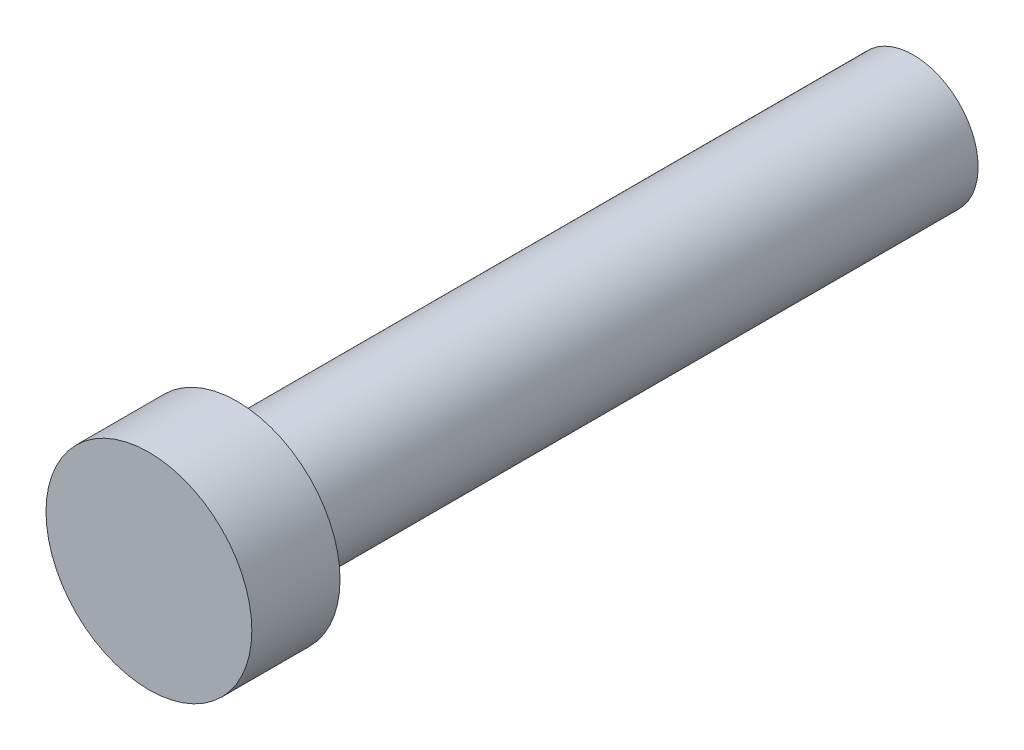
from build123d import *

# Parameters (mm, degrees)
SKETCH1_R           = 2.2
BOSS_EXTRUDE1_DEPTH = 26
SKETCH2_R           = 3.5
BOSS_EXTRUDE2_DEPTH = 3
SKETCH3_R           = 1
CUT_EXTRUDE1_DEPTH  = 5


with BuildPart() as part:
    # Sketch1 → Boss-Extrude1 (new body)
    with BuildSketch(Plane.XY):
        with Locations(Location((0, 0, 0), (0, 0, 180))):
            Circle(SKETCH1_R)
    extrude(amount=BOSS_EXTRUDE1_DEPTH)

    # Sketch2 → Boss-Extrude2 (add)
    with BuildSketch(Plane.XY.offset(26)):
        Circle(SKETCH2_R)
    extrude(amount=-BOSS_EXTRUDE2_DEPTH)

    # Sketch3 → Cut-Extrude1 (cut)
    with BuildSketch(Plane(origin=(0, 0, 0), x_dir=(-1, 0, 0), z_dir=(0, 0, -1))):
        Circle(SKETCH3_R)
    extrude(amount=-CUT_EXTRUDE1_DEPTH, mode=Mode.SUBTRACT)


solid = part.part
